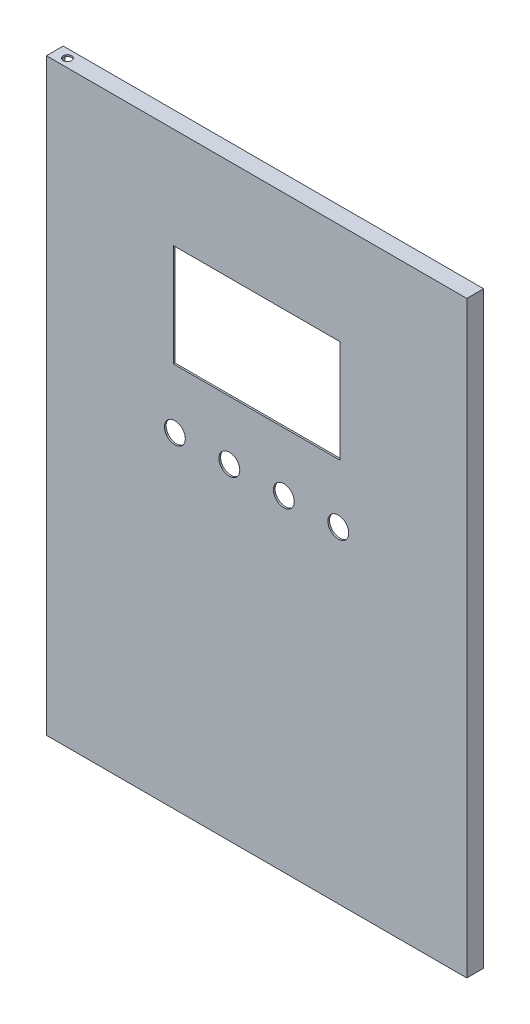
from build123d import *

# Parameters (mm, degrees)
SKETCH1_W               = 250
SKETCH1_H               = 350
BOSS_EXTRUDE1_DEPTH     = 10
SKETCH2_W               = 248
SKETCH2_H               = 348
CUT_EXTRUDE1_DEPTH      = 9
CUT_EXTRUDE2_DEPTH      = 431.232495286
CUT_EXTRUDE2_DEPTH_BACK = 431.232495286
SKETCH3_R               = 2.5
SKETCH4_W               = 99
SKETCH4_H               = 61
CUT_EXTRUDE3_DEPTH      = 10
CUT_EXTRUDE4_REACH      = 432.232
SKETCH5_R               = 6.2


with BuildPart() as part:
    # Sketch1 → Boss-Extrude1 (new body)
    with BuildSketch(Plane.XY):
        with Locations((125, -175)):
            Rectangle(SKETCH1_W, SKETCH1_H)
    extrude(amount=BOSS_EXTRUDE1_DEPTH)

    # Sketch2 → Cut-Extrude1 (cut)
    with BuildSketch(Plane(origin=(0, 0, 0), x_dir=(-1, 0, 0), z_dir=(0, 0, -1))):
        with Locations((-125, -175)):
            Rectangle(SKETCH2_W, SKETCH2_H)
    extrude(amount=-CUT_EXTRUDE1_DEPTH, mode=Mode.SUBTRACT)

    # Sketch3 → Cut-Extrude2 (cut, two sides: drawn at the far end of the back side and taken through both)
    with BuildSketch(Plane(origin=(0, 0, 0), x_dir=(1, 0, 0), z_dir=(0, 1, 0)).offset(-CUT_EXTRUDE2_DEPTH_BACK)):
        with Locations(Location((7.5, -5, 0), (0, 0, 270))):
            Circle(SKETCH3_R)
    extrude(amount=CUT_EXTRUDE2_DEPTH + CUT_EXTRUDE2_DEPTH_BACK, mode=Mode.SUBTRACT)

    # Sketch4 → Cut-Extrude3 (cut)
    with BuildSketch(Plane.XY.offset(10)):
        with Locations((125, -90.5)):
            Rectangle(SKETCH4_W, SKETCH4_H)
    extrude(amount=-CUT_EXTRUDE3_DEPTH, mode=Mode.SUBTRACT)

    # Sketch5 → Cut-Extrude4 (cut, up to next)
    with BuildSketch(Plane.XY.offset(10), mode=Mode.PRIVATE) as cut_extrude4_sk1:
        with Locations((108.8, -156)):
            Circle(SKETCH5_R)
    cut_extrude4_tool1 = extrude(cut_extrude4_sk1.sketch, amount=-CUT_EXTRUDE4_REACH, mode=Mode.PRIVATE) & part.part
    # Sketch5 → Cut-Extrude4 (cut, up to next)
    with BuildSketch(Plane.XY.offset(10), mode=Mode.PRIVATE) as cut_extrude4_sk2:
        with Locations((141.2, -156)):
            Circle(SKETCH5_R)
    cut_extrude4_tool2 = extrude(cut_extrude4_sk2.sketch, amount=-CUT_EXTRUDE4_REACH, mode=Mode.PRIVATE) & part.part
    # Sketch5 → Cut-Extrude4 (cut, up to next)
    with BuildSketch(Plane.XY.offset(10), mode=Mode.PRIVATE) as cut_extrude4_sk3:
        with Locations((76.4, -156)):
            Circle(SKETCH5_R)
    cut_extrude4_tool3 = extrude(cut_extrude4_sk3.sketch, amount=-CUT_EXTRUDE4_REACH, mode=Mode.PRIVATE) & part.part
    # Sketch5 → Cut-Extrude4 (cut, up to next)
    with BuildSketch(Plane.XY.offset(10), mode=Mode.PRIVATE) as cut_extrude4_sk4:
        with Locations(Location((173.6, -156, 0), (0, 0, 180))):
            Circle(SKETCH5_R)
    cut_extrude4_tool4 = extrude(cut_extrude4_sk4.sketch, amount=-CUT_EXTRUDE4_REACH, mode=Mode.PRIVATE) & part.part
    add(cut_extrude4_tool1.solids().sort_by_distance((108.8, -156, 10))[0], mode=Mode.SUBTRACT)
    add(cut_extrude4_tool2.solids().sort_by_distance((141.2, -156, 10))[0], mode=Mode.SUBTRACT)
    add(cut_extrude4_tool3.solids().sort_by_distance((76.4, -156, 10))[0], mode=Mode.SUBTRACT)
    add(cut_extrude4_tool4.solids().sort_by_distance((173.6, -156, 10))[0], mode=Mode.SUBTRACT)


solid = part.part
